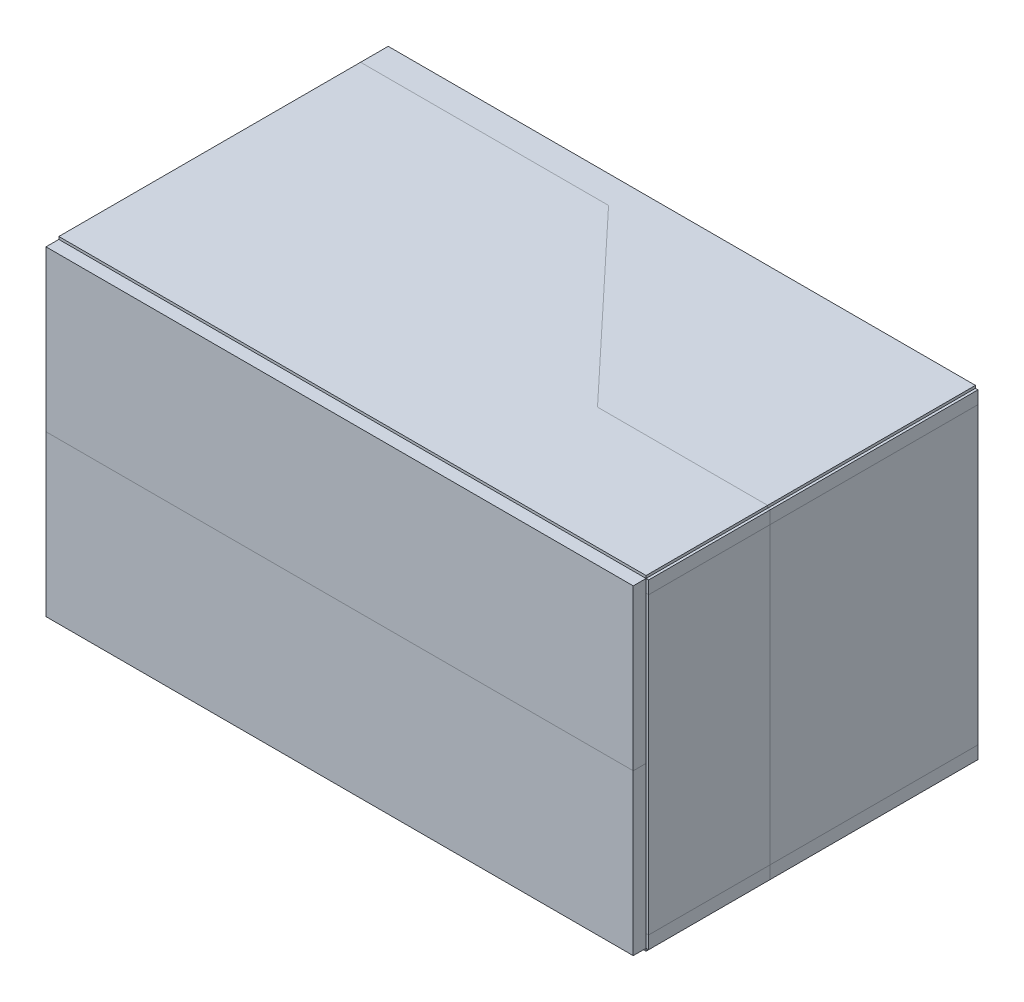
from build123d import *

# Parameters (mm, degrees)
SKETCH_1_W                    = 229
SKETCH_1_H                    = 124.895981316
EXTRUDE_1_DEPTH               = 7.860636733
SKETCH_2_W                    = 229
SKETCH_2_H                    = 5
CUT_EXTRUDE_1_DEPTH           = 7.860636733
SKETCH_4_W                    = 229
SKETCH_4_H                    = 5
CUT_EXTRUDE_2_DEPTH           = 7.860636733
SKETCH_5_W                    = 5
SKETCH_5_H                    = 114.895981316
CUT_EXTRUDE_3_DEPTH           = 7.860636733
SKETCH_6_W                    = 229
SKETCH_6_H                    = 128.442125646
EXTRUDE_3_DEPTH               = 5
SKETCH_7_W                    = 5
SKETCH_7_H                    = 114.895981316
EXTRUDE_4_DEPTH               = 120.581488912
SKETCH_8_W                    = 229
SKETCH_8_H                    = 128.442125646
EXTRUDE_5_DEPTH               = 5
SKETCH_9_W                    = 229
SKETCH_9_H                    = 62.45
EXTRUDE_6_DEPTH               = 5
SKETCH_10_W                   = 229
SKETCH_10_H                   = 62.445981316
EXTRUDE_7_DEPTH               = 5
SKETCH_11_W                   = 128.442125646
SKETCH_11_H                   = 114.895981316
EXTRUDE_8_DEPTH               = 5
EXTRUDE_9_DEPTH               = 1
EXTRUDE_10_DEPTH              = 1
SKETCH_14_W                   = 47.406489423
SKETCH_14_H                   = 5
EXTRUDE_11_DEPTH              = 1
SKETCH_15_W                   = 81.035636223
SKETCH_15_H                   = 5
EXTRUDE_12_DEPTH              = 1
SKETCH_16_W                   = 47.406489423
SKETCH_16_H                   = 114.895981316
EXTRUDE_13_DEPTH              = 1
SKETCH_17_W                   = 81.035636223
SKETCH_17_H                   = 114.895981316
EXTRUDE_14_DEPTH              = 1
EXTRUDE_15_DEPTH              = 118
SKETCH_19_W                   = 80
SKETCH_19_H                   = 7
EXTRUDE_16_DEPTH              = 30
EXTRUDE_17_DEPTH              = 80
SKETCH_21_W                   = 76
SKETCH_21_H                   = 39.64961299
CUT_EXTRUDE_4_DEPTH           = 5
SKETCH_22_W                   = 85.829259629
SKETCH_22_H                   = 10.691534072
EXTRUDE_18_DEPTH              = 50
SKETCH_23_W                   = 75.829259629
SKETCH_23_H                   = 10.691534072
CUT_EXTRUDE_5_DEPTH           = 45
SKETCH_24_W                   = 2
SKETCH_24_H                   = 10.691534072
EXTRUDE_19_DEPTH              = 75.829259628
SKETCH_25_R                   = 3.5
CUT_EXTRUDE_6_DEPTH           = 5
SKETCH_26_W                   = 0.8
SKETCH_26_H                   = 0.5
EXTRUDE_20_DEPTH              = 51
SKETCH_27_W                   = 4.099132482
SKETCH_27_H                   = 7.132449752
EXTRUDE_21_DEPTH              = 0.8
FILLET_1_R                    = 1
FILLET_2_R                    = 1
CUT_EXTRUDE_7_DEPTH           = 0.2
CUT_EXTRUDE_7_DRAFT           = -30
CUT_EXTRUDE_7_PROFILE_2_DEPTH = 0.2
CUT_EXTRUDE_7_PROFILE_2_DRAFT = -30
CUT_EXTRUDE_7_PROFILE_3_DEPTH = 0.2
CUT_EXTRUDE_7_PROFILE_3_DRAFT = -30
PATTERN_LINEAR_1_COUNT        = 5
PATTERN_LINEAR_1_PITCH        = 15
SKETCH_29_W                   = 100
SKETCH_29_H                   = 60
EXTRUDE_22_DEPTH              = 1
SKETCH_34_R                   = 1.5
EXTRUDE_24_DEPTH              = 5
SKETCH_35_R                   = 1.3
CUT_EXTRUDE_9_DEPTH           = 5
CUT_EXTRUDE_9_DRAFT           = -10
SKETCH_38_W                   = 10
SKETCH_38_H                   = 10
EXTRUDE_25_DEPTH              = 27
SKETCH_39_W                   = 45
SKETCH_39_H                   = 45
EXTRUDE_26_DEPTH              = 5
CUT_EXTRUDE_10_DEPTH          = 0.1


with BuildPart() as part:
    # 스케치1 → 보스-돌출1 (new body)
    with BuildSketch(Plane.XY):
        with Locations((165.5, 12.447990658)):
            Rectangle(SKETCH_1_W, SKETCH_1_H)
    extrude(amount=EXTRUDE_1_DEPTH)

    # 스케치2 → 컷-돌출1 (cut)
    with BuildSketch(Plane.XY.offset(7.860636733)):
        with Locations((165.5, 72.395981316)):
            Rectangle(SKETCH_2_W, SKETCH_2_H)
    extrude(amount=-CUT_EXTRUDE_1_DEPTH, mode=Mode.SUBTRACT)

    # 스케치4 → 컷-돌출2 (cut)
    with BuildSketch(Plane.XY.offset(7.860636733)):
        with Locations((165.5, -47.5)):
            Rectangle(SKETCH_4_W, SKETCH_4_H)
    extrude(amount=-CUT_EXTRUDE_2_DEPTH, mode=Mode.SUBTRACT)

    # 스케치5 → 컷-돌출3 (cut)
    with BuildSketch(Plane.XY.offset(7.860636733)):
        with Locations((277.5, 12.447990658)):
            Rectangle(SKETCH_5_W, SKETCH_5_H)
    extrude(amount=-CUT_EXTRUDE_3_DEPTH, mode=Mode.SUBTRACT)


with BuildPart() as body_2:
    # 스케치6 → 보스-돌출3 (new body)
    with BuildSketch(Plane(origin=(0, 69.895981316, 0), x_dir=(1, 0, 0), z_dir=(0, 1, 0))):
        with Locations((165.5, -64.221062823)):
            Rectangle(SKETCH_6_W, SKETCH_6_H)
    extrude(amount=EXTRUDE_3_DEPTH)

    # 스케치41 → 컷-돌출10 (cut)
    with BuildSketch(Plane.XZ.offset(-69.895981316)):
        Polygon((147.775530182, 128.442125646), (280, 128.442125646), (280, 7.860636733), (213.81085188, 7.860636733), (212.675209533, 7.860636733), align=None)
    extrude(amount=-CUT_EXTRUDE_10_DEPTH, mode=Mode.SUBTRACT)


with BuildPart() as body_3:
    # 스케치7 → 보스-돌출4 (new body)
    with BuildSketch(Plane.XY.offset(7.860636733)):
        with Locations((53.5, 12.447990658)):
            Rectangle(SKETCH_7_W, SKETCH_7_H)
    extrude(amount=EXTRUDE_4_DEPTH)


with BuildPart() as body_4:
    # 스케치8 → 보스-돌출5 (new body)
    with BuildSketch(Plane.XZ.offset(45)):
        with Locations((165.5, 64.221062823)):
            Rectangle(SKETCH_8_W, SKETCH_8_H)
    extrude(amount=EXTRUDE_5_DEPTH)


with BuildPart() as body_5:
    # 스케치9 → 보스-돌출6 (new body)
    with BuildSketch(Plane.XY.offset(128.442125646)):
        with Locations((165.5, 43.670981316)):
            Rectangle(SKETCH_9_W, SKETCH_9_H)
    extrude(amount=EXTRUDE_6_DEPTH)


with BuildPart() as body_6:
    # 스케치10 → 보스-돌출7 (new body)
    with BuildSketch(Plane.XY.offset(128.442125646)):
        with Locations((165.5, -18.777009342)):
            Rectangle(SKETCH_10_W, SKETCH_10_H)
    extrude(amount=EXTRUDE_7_DEPTH)


with BuildPart() as body_7:
    # 스케치11 → 보스-돌출8 (new body)
    with BuildSketch(Plane(origin=(275, 0, 0), x_dir=(0, 0, -1), z_dir=(1, 0, 0))):
        with Locations((-64.221062823, 12.447990658)):
            Rectangle(SKETCH_11_W, SKETCH_11_H)
    extrude(amount=EXTRUDE_8_DEPTH)


with BuildPart() as body_8:
    # 스케치12 → 보스-돌출9 (new body)
    with BuildSketch(Plane.XZ.offset(50)):
        Polygon((51, 10.771238208), (147.705868367, 10.771238208), (213.658520424, 81.035636223), (280, 81.035636223), (280, 0), (51, 0), align=None)
    extrude(amount=EXTRUDE_9_DEPTH)


with BuildPart() as body_9:
    # 스케치13 → 보스-돌출10 (new body)
    with BuildSketch(Plane.XZ.offset(50)):
        Polygon((51, 128.442125646), (51, 10.771238208), (147.705868367, 10.771238208), (213.658520424, 81.035636223), (280, 81.035636223), (280, 128.442125646), align=None)
    extrude(amount=EXTRUDE_10_DEPTH)


with BuildPart() as body_10:
    # 스케치14 → 보스-돌출11 (new body)
    with BuildSketch(Plane(origin=(280, 0, 0), x_dir=(0, 0, -1), z_dir=(1, 0, 0))):
        with Locations((-104.738880935, -47.5)):
            Rectangle(SKETCH_14_W, SKETCH_14_H)
    extrude(amount=EXTRUDE_11_DEPTH)


with BuildPart() as body_11:
    # 스케치15 → 보스-돌출12 (new body)
    with BuildSketch(Plane(origin=(280, 0, 0), x_dir=(0, 0, -1), z_dir=(1, 0, 0))):
        with Locations((-40.517818112, -47.5)):
            Rectangle(SKETCH_15_W, SKETCH_15_H)
    extrude(amount=EXTRUDE_12_DEPTH)


with BuildPart() as body_12:
    # 스케치16 → 보스-돌출13 (new body)
    with BuildSketch(Plane(origin=(280, 0, 0), x_dir=(0, 0, -1), z_dir=(1, 0, 0))):
        with Locations((-104.738880935, 12.447990658)):
            Rectangle(SKETCH_16_W, SKETCH_16_H)
    extrude(amount=EXTRUDE_13_DEPTH)


with BuildPart() as body_13:
    # 스케치17 → 보스-돌출14 (new body)
    with BuildSketch(Plane(origin=(280, 0, 0), x_dir=(0, 0, -1), z_dir=(1, 0, 0))):
        with Locations((-40.517818112, 12.447990658)):
            Rectangle(SKETCH_17_W, SKETCH_17_H)
    extrude(amount=EXTRUDE_14_DEPTH)


with BuildPart() as body_14:
    # 대칭 복사2: mirrored copy
    add(body_8.part.mirror(Plane.ZX.offset(12.445981316)))


with BuildPart() as body_15:
    # Mirror 2 2: mirrored copy
    add(body_9.part.mirror(Plane.ZX.offset(12.445981316)))


with BuildPart() as body_16:
    # Mirror 2 3: mirrored copy
    add(body_10.part.mirror(Plane.ZX.offset(12.445981316)))


with BuildPart() as body_17:
    # Mirror 2 4: mirrored copy
    add(body_11.part.mirror(Plane.ZX.offset(12.445981316)))


with BuildPart() as body_18:
    # 스케치18 → 보스-돌출15 (new body)
    with BuildSketch(Plane.XY.offset(7.860636733)):
        with BuildLine():
            Line((76, 69.895981316), (76, 67.895981316))
            add(Edge.make_bspline(
                [(76, 67.895981316), (75.533148883, 67.895981316), (74.599446649, 67.766776032), (72.609286568, 66.933236207), (69.874830036, 64.600897364), (66.608746246, 59.613861052), (63.663869287, 52.684295834), (61.215816662, 44.122651244), (58.773989679, 31.01585296), (57.484006881, 12.447990658), (58.773989679, -6.119871645), (61.215816662, -19.226669929), (63.663869287, -27.788314518), (66.608746246, -34.717879737), (69.874830036, -39.704916048), (72.609286568, -42.037254891), (74.599446649, -42.870794716), (75.533148883, -43), (76, -43)],
                knots=[0, 0, 0, 0, 0.09817477, 0.196349541, 0.392699082, 0.589048623, 0.785398163, 0.981747704, 1.178097245, 1.570796327, 1.963495408, 2.159844949, 2.35619449, 2.552544031, 2.748893572, 2.945243113, 3.043417883, 3.141592654, 3.141592654, 3.141592654, 3.141592654], degree=3))
            Line((76, -43), (76, -45))
            add(Edge.make_bspline(
                [(76, 69.895981316), (56, 69.895981316), (56, 12.447990658), (56, -45), (76, -45)],
                knots=[0, 0, 0, 1.570796327, 1.570796327, 3.141592654, 3.141592654, 3.141592654], degree=2, weights=[1, 0.707106781, 1, 0.707106781, 1]))
        make_face()
    extrude(amount=EXTRUDE_15_DEPTH)


with BuildPart() as body_19:
    # 스케치19 → 보스-돌출16 (new body)
    with BuildSketch(Plane.XY.offset(7.860636733)):
        with Locations((215, 53.470726754)):
            Rectangle(SKETCH_19_W, SKETCH_19_H)
    extrude(amount=EXTRUDE_16_DEPTH)

    # 스케치20 → 보스-돌출17 (add)
    with BuildSketch(Plane(origin=(255, 0, 0), x_dir=(0, 0, -1), z_dir=(1, 0, 0))):
        Polygon((-37.860636733, 49.970726754), (-37.860636733, 56.970726754), (-80.120872498, 67.895981316), (-80.120872498, 60.895981316), align=None)
    extrude(amount=-EXTRUDE_17_DEPTH)

    # 스케치21 → 컷-돌출4 (cut)
    with BuildSketch(Plane(origin=(0, 37.665522709, -9.737414293), x_dir=(1, 0, 0), z_dir=(0, -0.9681697699141082, 0.2502944198827914))):
        with Locations((215, 70.987724514)):
            Rectangle(SKETCH_21_W, SKETCH_21_H)
    extrude(amount=-CUT_EXTRUDE_4_DEPTH, mode=Mode.SUBTRACT)


with BuildPart() as body_20:
    # 스케치22 → 보스-돌출18 (new body)
    with BuildSketch(Plane.XY.offset(7.860636733)):
        with Locations((123.382357244, 57.246909664)):
            Rectangle(SKETCH_22_W, SKETCH_22_H)
    extrude(amount=EXTRUDE_18_DEPTH)

    # 스케치23 → 컷-돌출5 (cut)
    with BuildSketch(Plane.XY.offset(57.860636733)):
        with Locations((123.382357244, 57.246909664)):
            Rectangle(SKETCH_23_W, SKETCH_23_H)
    extrude(amount=-CUT_EXTRUDE_5_DEPTH, mode=Mode.SUBTRACT)

    # 스케치24 → 보스-돌출19 (add)
    with BuildSketch(Plane(origin=(85.467727429, 0, 0), x_dir=(0, 0, -1), z_dir=(1, 0, 0))):
        with Locations((-44.50281779, 57.246909664)):
            Rectangle(SKETCH_24_W, SKETCH_24_H)
    extrude(amount=EXTRUDE_19_DEPTH)

    # 스케치25 → 컷-돌출6 (cut)
    with BuildSketch(Plane.XY.offset(45.50281779)):
        with Locations((95.092025082, 57.252313468)):
            Circle(SKETCH_25_R)
        with Locations((110.092025082, 57.252313468)):
            Circle(SKETCH_25_R)
        with Locations((125.092025082, 57.252313468)):
            Circle(SKETCH_25_R)
        with Locations((140.092025082, 57.252313468)):
            Circle(SKETCH_25_R)
        with Locations((155.092025082, 57.252313468)):
            Circle(SKETCH_25_R)
    extrude(amount=-CUT_EXTRUDE_6_DEPTH, mode=Mode.SUBTRACT)


with BuildPart() as body_21:
    # 스케치26 → 보스-돌출20 (new body)
    with BuildSketch(Plane.XY.offset(12.860636733)):
        with Locations((95.201070834, 54.014427915)):
            Rectangle(SKETCH_26_W, SKETCH_26_H)
    extrude(amount=EXTRUDE_20_DEPTH)

    # 스케치27 → 보스-돌출21 (add)
    with BuildSketch(Plane(origin=(95.601070834, 0, 0), x_dir=(0, 0, -1), z_dir=(1, 0, 0))):
        with Locations((-65.910202974, 57.330652791)):
            Rectangle(SKETCH_27_W, SKETCH_27_H)
    extrude(amount=-EXTRUDE_21_DEPTH)

    # 필렛1
    fillet_1_edges = [body_21.edges().sort_by_distance(p)[0] for p in [
        (95.201070834, 60.896877667, 67.959769215),
    ]]
    fillet(fillet_1_edges, radius=FILLET_1_R)

    # 필렛2
    fillet_2_edges = [body_21.edges().sort_by_distance(p)[0] for p in [
        (95.201070834, 60.896877667, 63.860636733),
    ]]
    fillet(fillet_2_edges, radius=FILLET_2_R)


with BuildPart() as cut_extrude_7_tool:
    # 스케치28 → 컷-돌출7 (with draft: the straight prism first)
    with BuildSketch(Plane(origin=(95.601070834, 0, 0), x_dir=(0, 0, -1), z_dir=(1, 0, 0))):
        with BuildLine():
            ThreePointArc((-67.159693301, 54.877579641), (-66.860509737, 54.578396077), (-66.561326172, 54.877579641))
            Line((-66.561326172, 54.877579641), (-66.561326172, 59.040133578))
            ThreePointArc((-66.561326172, 59.040133578), (-66.860509737, 59.339317142), (-67.159693301, 59.040133578))
            Line((-67.159693301, 59.040133578), (-67.159693301, 54.877579641))
        make_face()
    extrude(amount=-CUT_EXTRUDE_7_DEPTH)
    # 컷-돌출7: the draft: its side faces are tilted about the plane it starts from
    cut_extrude_7_sides = [cut_extrude_7_tool.faces().sort_by_distance(p)[0] for p in [
        (95.501070834, 54.578396077, 66.860509737),
        (95.501070834, 56.958856609, 66.561326172),
        (95.501070834, 59.339317142, 66.860509737),
        (95.501070834, 56.958856609, 67.159693301),
    ]]
    draft(cut_extrude_7_sides, Plane(origin=(95.601070834, 0, 0), x_dir=(0, 0, -1), z_dir=(1, 0, 0)), CUT_EXTRUDE_7_DRAFT)


with BuildPart() as body_21_1:
    add(body_21.part)

    # 컷-돌출7: cut by cut_extrude_7_tool
    add(cut_extrude_7_tool.part, mode=Mode.SUBTRACT)


with BuildPart() as cut_extrude_7_profile_2_tool:
    # 스케치28 → 컷-돌출7 profile 2 (with draft: the straight prism first)
    with BuildSketch(Plane(origin=(95.601070834, 0, 0), x_dir=(0, 0, -1), z_dir=(1, 0, 0))):
        with BuildLine():
            ThreePointArc((-66.159693301, 54.877579641), (-65.860509737, 54.578396077), (-65.561326172, 54.877579641))
            Line((-65.561326172, 54.877579641), (-65.561326172, 59.040133578))
            ThreePointArc((-65.561326172, 59.040133578), (-65.860509737, 59.339317142), (-66.159693301, 59.040133578))
            Line((-66.159693301, 59.040133578), (-66.159693301, 54.877579641))
        make_face()
    extrude(amount=-CUT_EXTRUDE_7_PROFILE_2_DEPTH)
    # 컷-돌출7 profile 2: the draft: its side faces are tilted about the plane it starts from
    cut_extrude_7_profile_2_sides = [cut_extrude_7_profile_2_tool.faces().sort_by_distance(p)[0] for p in [
        (95.501070834, 54.578396077, 65.860509737),
        (95.501070834, 56.958856609, 65.561326172),
        (95.501070834, 59.339317142, 65.860509737),
        (95.501070834, 56.958856609, 66.159693301),
    ]]
    draft(cut_extrude_7_profile_2_sides, Plane(origin=(95.601070834, 0, 0), x_dir=(0, 0, -1), z_dir=(1, 0, 0)), CUT_EXTRUDE_7_PROFILE_2_DRAFT)


with BuildPart() as body_21_2:
    add(body_21_1.part)

    # 컷-돌출7 profile 2: cut by cut_extrude_7_profile_2_tool
    add(cut_extrude_7_profile_2_tool.part, mode=Mode.SUBTRACT)


with BuildPart() as cut_extrude_7_profile_3_tool:
    # 스케치28 → 컷-돌출7 profile 3 (with draft: the straight prism first)
    with BuildSketch(Plane(origin=(95.601070834, 0, 0), x_dir=(0, 0, -1), z_dir=(1, 0, 0))):
        with BuildLine():
            ThreePointArc((-65.159693301, 54.877579641), (-64.860509737, 54.578396077), (-64.561326172, 54.877579641))
            Line((-64.561326172, 54.877579641), (-64.561326172, 59.040133578))
            ThreePointArc((-64.561326172, 59.040133578), (-64.860509737, 59.339317142), (-65.159693301, 59.040133578))
            Line((-65.159693301, 59.040133578), (-65.159693301, 54.877579641))
        make_face()
    extrude(amount=-CUT_EXTRUDE_7_PROFILE_3_DEPTH)
    # 컷-돌출7 profile 3: the draft: its side faces are tilted about the plane it starts from
    cut_extrude_7_profile_3_sides = [cut_extrude_7_profile_3_tool.faces().sort_by_distance(p)[0] for p in [
        (95.501070834, 54.578396077, 64.860509737),
        (95.501070834, 56.958856609, 64.561326172),
        (95.501070834, 59.339317142, 64.860509737),
        (95.501070834, 56.958856609, 65.159693301),
    ]]
    draft(cut_extrude_7_profile_3_sides, Plane(origin=(95.601070834, 0, 0), x_dir=(0, 0, -1), z_dir=(1, 0, 0)), CUT_EXTRUDE_7_PROFILE_3_DRAFT)


with BuildPart() as body_21_3:
    add(body_21_2.part)

    # 컷-돌출7 profile 3: cut by cut_extrude_7_profile_3_tool
    add(cut_extrude_7_profile_3_tool.part, mode=Mode.SUBTRACT)


with BuildPart() as pattern_linear_1_1:
    # 선형 패턴1: pattern copy
    add(body_21_3.part.moved(Location(Vector(1, 0, 0) * (1 * PATTERN_LINEAR_1_PITCH))))


with BuildPart() as pattern_linear_1_2:
    # 선형 패턴1: pattern copy
    add(body_21_3.part.moved(Location(Vector(1, 0, 0) * (2 * PATTERN_LINEAR_1_PITCH))))


with BuildPart() as pattern_linear_1_3:
    # 선형 패턴1: pattern copy
    add(body_21_3.part.moved(Location(Vector(1, 0, 0) * (3 * PATTERN_LINEAR_1_PITCH))))


with BuildPart() as pattern_linear_1_4:
    # 선형 패턴1: pattern copy
    add(body_21_3.part.moved(Location(Vector(1, 0, 0) * (4 * PATTERN_LINEAR_1_PITCH))))


with BuildPart() as body_26:
    # 스케치29 → 보스-돌출22 (new body)
    with BuildSketch(Plane.XY.offset(7.860636733)):
        with Locations((145, 0.378195334)):
            Rectangle(SKETCH_29_W, SKETCH_29_H)
    extrude(amount=EXTRUDE_22_DEPTH)


with BuildPart() as body_27:
    # 스케치34 → 보스-돌출24 (new body)
    with BuildSketch(Plane.XY.offset(8.860636733)):
        with Locations((175, 15.378195334)):
            Circle(SKETCH_34_R)
    extrude(amount=EXTRUDE_24_DEPTH)


with BuildPart() as cut_extrude_9_tool:
    # 스케치35 → 컷-돌출9 (with draft: the straight prism first)
    with BuildSketch(Plane.XY.offset(13.860636733)):
        with Locations((175, 15.378195334)):
            Circle(SKETCH_35_R)
    extrude(amount=-CUT_EXTRUDE_9_DEPTH)
    # 컷-돌출9: the draft: its side faces are tilted about the plane it starts from
    cut_extrude_9_sides = [cut_extrude_9_tool.faces().sort_by_distance(p)[0] for p in [
        (173.7, 15.378195334, 11.360636733),
    ]]
    draft(cut_extrude_9_sides, Plane.XY.offset(13.860636733), CUT_EXTRUDE_9_DRAFT)


with BuildPart() as body_27_1:
    add(body_27.part)

    # 컷-돌출9: cut by cut_extrude_9_tool
    add(cut_extrude_9_tool.part, mode=Mode.SUBTRACT)


with BuildPart() as body_28:
    # 스케치37 → 회전2 (revolve)
    with BuildSketch(Plane.XY.offset(15.860636733)):
        with BuildLine():
            Line((175, 16.878195334), (175, 13.878195334))
            ThreePointArc((175, 13.878195334), (176.5, 15.378195334), (175, 16.878195334))
        make_face()
    revolve(axis=Axis((175, 16.878195334, 15.860636733), (0, -1, 0)))


with BuildPart() as body_29:
    # 스케치38 → 보스-돌출25 (new body)
    with BuildSketch(Plane.XY.offset(7.860636733)):
        with Locations((240.530439143, 2.145841153)):
            Rectangle(SKETCH_38_W, SKETCH_38_H)
    extrude(amount=EXTRUDE_25_DEPTH)

    # 스케치39 → 보스-돌출26 (add)
    with BuildSketch(Plane.XY.offset(34.860636733)):
        with Locations((240.530439143, 2.145841153)):
            Rectangle(SKETCH_39_W, SKETCH_39_H)
    extrude(amount=EXTRUDE_26_DEPTH)


solid = Compound([part.part, body_2.part, body_3.part, body_4.part, body_5.part, body_6.part, body_7.part, body_8.part, body_9.part, body_10.part, body_11.part, body_12.part, body_13.part, body_14.part, body_15.part, body_16.part, body_17.part, body_18.part, body_19.part, body_20.part, body_21_3.part, pattern_linear_1_1.part, pattern_linear_1_2.part, pattern_linear_1_3.part, pattern_linear_1_4.part, body_26.part, body_27_1.part, body_28.part, body_29.part])
